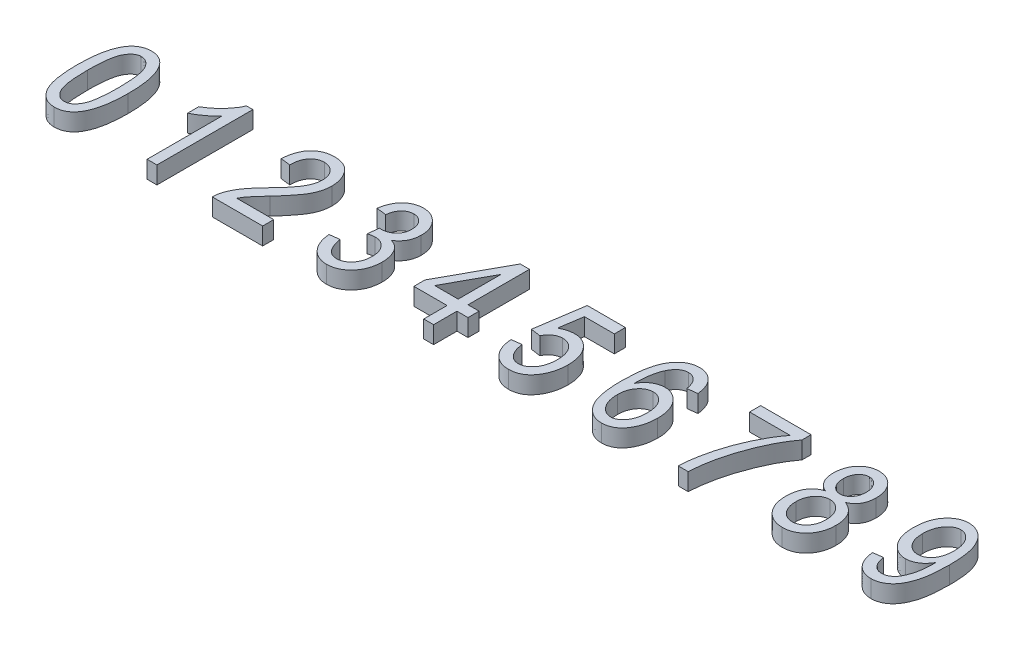
from build123d import *

# Parameters (mm, degrees)
EXTRUDE_1_DEPTH    = 4
EXTRUDE_1_2_DEPTH  = 4
EXTRUDE_1_3_DEPTH  = 4
EXTRUDE_1_4_DEPTH  = 4
EXTRUDE_1_5_DEPTH  = 4
EXTRUDE_1_6_DEPTH  = 4
EXTRUDE_1_7_DEPTH  = 4
EXTRUDE_1_8_DEPTH  = 4
EXTRUDE_1_9_DEPTH  = 4
EXTRUDE_1_10_DEPTH = 4


with BuildPart() as part:
    # 草图1 → 凸台-拉伸1 (new body)
    with BuildSketch(Plane(origin=(0, 0, 0), x_dir=(1, 0, 0), z_dir=(0, 1, 0))):
        with BuildLine():
            add(Edge.make_bspline(
                [(1.133928571, 10.905203683), (1.137529852, 11.35119896), (1.144522674, 12.217214526), (1.216791983, 13.473272052), (1.330782075, 14.646708835), (1.485793215, 15.735951426), (1.695582536, 16.741163355), (1.94263042, 17.663957339), (2.246054489, 18.501398793), (2.587577016, 19.257078625), (2.979224816, 19.926777329), (3.410999943, 20.512796209), (3.895710436, 21.005624194), (4.419990969, 21.415429855), (4.994271432, 21.727630034), (5.610377987, 21.952001951), (6.270588186, 22.087397113), (6.726156325, 22.103427807), (6.958600725, 22.111607143)],
                knots=[0, 0, 0, 0, 1.522295809, 2.955932353, 4.292935845, 5.545987552, 6.709403679, 7.796379217, 8.803980711, 9.746667296, 10.623167879, 11.447716403, 12.224665142, 12.975696349, 13.710987297, 14.4460191, 15.207112772, 16, 16, 16, 16], degree=3))
            add(Edge.make_bspline(
                [(6.958600725, 22.111607143), (7.165745814, 22.104962062), (7.572531355, 22.091912644), (8.166134358, 21.984299805), (8.724456336, 21.801225178), (9.247919006, 21.546805984), (9.734932291, 21.218327908), (10.190287784, 20.821156924), (10.608995529, 20.347285231), (10.851450348, 19.991296179), (10.976074219, 19.808314732)],
                knots=[0, 0, 0, 0, 1.02435884, 2.0116063, 2.972586715, 3.92329494, 4.881606269, 5.870473939, 6.905405214, 8, 8, 8, 8], degree=3))
            add(Edge.make_bspline(
                [(10.976074219, 19.808314732), (11.120329906, 19.561614301), (11.420324827, 19.048574728), (11.778533319, 18.188988192), (12.080470031, 17.228902198), (12.335050794, 16.165261158), (12.516649075, 14.99587192), (12.660372982, 13.725283268), (12.74355333, 12.350301469), (12.752210324, 11.398455669), (12.756696429, 10.905203683)],
                knots=[0, 0, 0, 0, 0.745747152, 1.550859881, 2.42529298, 3.372802996, 4.404287875, 5.514077945, 6.711780846, 8, 8, 8, 8], degree=3))
            add(Edge.make_bspline(
                [(12.756696429, 10.905203683), (12.753138803, 10.462155677), (12.746232095, 9.602030675), (12.673239555, 8.351955016), (12.560768223, 7.184220416), (12.403651674, 6.0983), (12.195807953, 5.095555907), (11.945477506, 4.173012857), (11.651522887, 3.331079351), (11.305272962, 2.575318947), (10.919390548, 1.901712989), (10.48029085, 1.321632525), (10.007261895, 0.819996036), (9.476175946, 0.419066702), (8.905813914, 0.098029702), (8.285555125, -0.12256056), (7.623144178, -0.259853395), (7.165996812, -0.275482839), (6.932024275, -0.283482143)],
                knots=[0, 0, 0, 0, 1.513874866, 2.939007974, 4.277477108, 5.521918538, 6.686610019, 7.774777114, 8.786532326, 9.730252297, 10.61206932, 11.433487149, 12.211385775, 12.960169701, 13.698700869, 14.439280195, 15.201208188, 16, 16, 16, 16], degree=3))
            add(Edge.make_bspline(
                [(6.932024275, -0.283482143), (6.723338871, -0.275649401), (6.313039884, -0.260249351), (5.71102332, -0.143160033), (5.14124749, 0.058723627), (4.600702622, 0.336080314), (4.088670117, 0.690678413), (3.611406087, 1.129987143), (3.157379678, 1.642442393), (2.732051489, 2.237491832), (2.347702748, 2.930431249), (2.022804647, 3.737753777), (1.746001423, 4.655603116), (1.526344673, 5.687684837), (1.341459696, 6.829780524), (1.225266592, 8.087618572), (1.148252418, 9.458771727), (1.1388279, 10.410466121), (1.133928571, 10.905203683)],
                knots=[0, 0, 0, 0, 0.713782411, 1.403376538, 2.088831486, 2.775699897, 3.476400496, 4.213162367, 4.989742879, 5.815463779, 6.710980744, 7.6941898, 8.787315853, 9.987366569, 11.302150399, 12.743876293, 14.307306722, 16, 16, 16, 16], degree=3))
        make_face()
        with BuildLine():
            add(Edge.make_bspline(
                [(3.401785714, 10.9140625), (3.405740161, 10.488808859), (3.413294327, 9.67644818), (3.45480889, 8.510698927), (3.533275445, 7.455693007), (3.642257478, 6.50810622), (3.78042876, 5.671852779), (3.950963924, 4.942328507), (4.154173298, 4.322499768), (4.393249178, 3.803541371), (4.658367759, 3.372739202), (4.941548594, 3.005644831), (5.234348733, 2.687276221), (5.554419105, 2.432964272), (5.88671233, 2.227335152), (6.244068769, 2.093161663), (6.613883115, 1.996316217), (6.869367785, 1.98838346), (6.998465402, 1.984375)],
                knots=[0, 0, 0, 0, 1.930873368, 3.688541263, 5.295281011, 6.732986767, 8.018032389, 9.141589856, 10.131594649, 10.974379403, 11.729767228, 12.422984227, 13.077418253, 13.687793181, 14.274134012, 14.843047171, 15.415386244, 16, 16, 16, 16], degree=3))
            add(Edge.make_bspline(
                [(6.998465402, 1.984375), (7.12015937, 1.988577871), (7.362471427, 1.996946457), (7.715686044, 2.092803168), (8.056201196, 2.233414275), (8.378294063, 2.436914403), (8.681502115, 2.698655197), (8.969934794, 3.016432221), (9.244021563, 3.390594826), (9.506854351, 3.827857087), (9.743390125, 4.349451938), (9.944581903, 4.972226038), (10.113873806, 5.701516287), (10.253908537, 6.53733451), (10.355359306, 7.481174777), (10.436580956, 8.529808855), (10.477017665, 9.686805212), (10.484785748, 10.493245936), (10.488839286, 10.9140625)],
                knots=[0, 0, 0, 0, 0.556098029, 1.107279675, 1.665020537, 2.239289732, 2.843790749, 3.494855459, 4.20099618, 4.965402842, 5.827994078, 6.818278647, 7.958442113, 9.254955883, 10.697998423, 12.305588537, 14.072183745, 16, 16, 16, 16], degree=3))
            add(Edge.make_bspline(
                [(10.488839286, 10.9140625), (10.484803786, 11.339311075), (10.477066782, 12.154612777), (10.436445609, 13.321904263), (10.3565553, 14.379714291), (10.249501411, 15.326124774), (10.108681639, 16.163291329), (9.941524001, 16.892306317), (9.734992017, 17.51088787), (9.499311347, 18.028811135), (9.228796625, 18.455780917), (8.952595629, 18.828447123), (8.649919313, 19.138938816), (8.33177381, 19.397482964), (7.99352568, 19.598949972), (7.633690617, 19.742914474), (7.255066288, 19.829545416), (6.995956106, 19.838995253), (6.865583147, 19.84375)],
                knots=[0, 0, 0, 0, 1.926173374, 3.692928135, 5.28908838, 6.72993665, 8.005261178, 9.132588719, 10.113846285, 10.954579593, 11.702439438, 12.399284011, 13.051919516, 13.660808713, 14.251466784, 14.827675714, 15.41013748, 16, 16, 16, 16], degree=3))
            add(Edge.make_bspline(
                [(6.865583147, 19.84375), (6.743869359, 19.839658157), (6.502952364, 19.831558872), (6.152674508, 19.735298153), (5.816634719, 19.594548839), (5.496901341, 19.390143507), (5.197508892, 19.124714029), (4.906737199, 18.808905181), (4.638661533, 18.431368163), (4.374864924, 17.998108827), (4.142477119, 17.475118933), (3.94097321, 16.853428195), (3.778905963, 16.122829646), (3.635693389, 15.28952644), (3.535539039, 14.346892328), (3.453959667, 13.298334016), (3.41363159, 12.14131465), (3.405847569, 11.334877302), (3.401785714, 10.9140625)],
                knots=[0, 0, 0, 0, 0.557102101, 1.102712893, 1.655222221, 2.224793741, 2.834805151, 3.487045402, 4.190458401, 4.956245252, 5.811421647, 6.809929224, 7.950602775, 9.242777249, 10.688425301, 12.298918027, 14.068702942, 16, 16, 16, 16], degree=3))
        make_face(mode=Mode.SUBTRACT)
    extrude(amount=EXTRUDE_1_DEPTH)


with BuildPart() as body_2:
    # 草图1 → Extrude 1 2 (new body)
    with BuildSketch(Plane(origin=(0, 0, 0), x_dir=(1, 0, 0), z_dir=(0, 1, 0))):
        with BuildLine():
            Line((30.332589286, 0), (28.064732143, 0))
            Line((28.064732143, 0), (28.064732143, 17.292410714))
            add(Edge.make_bspline(
                [(28.064732143, 17.292410714), (27.925454756, 17.132090497), (27.636802515, 16.799827011), (27.135717027, 16.327302036), (26.577312613, 15.840032375), (25.959084786, 15.367208673), (25.329159841, 14.914320071), (24.706991895, 14.515996674), (24.11589952, 14.169425288), (23.719359966, 13.981047717), (23.529017857, 13.890625)],
                knots=[0, 0, 0, 0, 0.892555828, 1.849821039, 2.893015883, 4.008277588, 5.121255548, 6.154629642, 7.114207698, 8, 8, 8, 8], degree=3))
            Line((23.529017857, 13.890625), (23.529017857, 16.441964286))
            add(Edge.make_bspline(
                [(23.529017857, 16.441964286), (23.83491298, 16.626063613), (24.444083923, 16.992685871), (25.297612139, 17.627794014), (26.103929215, 18.313288839), (26.838934536, 19.056352798), (27.497051072, 19.8223405), (28.061927625, 20.586797168), (28.525090621, 21.341600562), (28.752286898, 21.860818224), (28.86202567, 22.111607143)],
                knots=[0, 0, 0, 0, 1.082272232, 2.155277244, 3.222407096, 4.289527553, 5.32168536, 6.282742408, 7.170542132, 8, 8, 8, 8], degree=3))
            Line((28.86202567, 22.111607143), (30.332589286, 22.111607143))
            Line((30.332589286, 22.111607143), (30.332589286, 0))
        make_face()
    extrude(amount=EXTRUDE_1_2_DEPTH)


with BuildPart() as body_3:
    # 草图1 → Extrude 1 3 (new body)
    with BuildSketch(Plane(origin=(0, 0, 0), x_dir=(1, 0, 0), z_dir=(0, 1, 0))):
        with BuildLine():
            Line((54.712053571, 2.551339286), (54.712053571, 0))
            Line((54.712053571, 0), (43.089285714, 0))
            add(Edge.make_bspline(
                [(43.089285714, 0), (43.088747573, 0.132935451), (43.087657288, 0.402264849), (43.123905785, 0.812881285), (43.198381432, 1.233438985), (43.293479235, 1.669548249), (43.428317547, 2.11547331), (43.593384654, 2.573380891), (43.788149325, 3.042130982), (44.016200988, 3.524499695), (44.282690832, 4.025113968), (44.604266837, 4.541879332), (44.97383741, 5.084065389), (45.391891298, 5.648366808), (45.866604654, 6.229431853), (46.383887479, 6.835886378), (46.951122103, 7.466467238), (47.354994361, 7.885557126), (47.562988281, 8.101388114)],
                knots=[0, 0, 0, 0, 0.672188691, 1.361865275, 2.08134618, 2.831455259, 3.618325166, 4.435686407, 5.292818481, 6.184803937, 7.133719261, 8.159707436, 9.261705982, 10.452168352, 11.710682541, 13.056179633, 14.483934645, 16, 16, 16, 16], degree=3))
            add(Edge.make_bspline(
                [(47.562988281, 8.101388114), (47.804700532, 8.351398073), (48.270098671, 8.832772802), (48.925102107, 9.543552089), (49.520238511, 10.204212605), (50.043617445, 10.826701042), (50.504530799, 11.402539282), (50.907615865, 11.930904009), (51.233609209, 12.423786125), (51.58558933, 13.003732731), (51.921152372, 13.694149979), (52.217809111, 14.498940518), (52.40948734, 15.27693348), (52.432851964, 15.789847664), (52.444196429, 16.038888114)],
                knots=[0, 0, 0, 0, 1.312560889, 2.527233899, 3.64818266, 4.668586789, 5.596397896, 6.432357998, 7.175835261, 7.825761013, 8.992224112, 10.065918602, 11.060925749, 12, 12, 12, 12], degree=3))
            add(Edge.make_bspline(
                [(52.444196429, 16.038888114), (52.442614597, 16.176378267), (52.439525115, 16.444910918), (52.387023702, 16.837074135), (52.31214977, 17.210082091), (52.213293991, 17.566630589), (52.073127896, 17.90086324), (51.905185273, 18.215098967), (51.708464326, 18.510760983), (51.483975848, 18.783507376), (51.236416126, 19.029558714), (50.975522917, 19.250604928), (50.694509295, 19.42950948), (50.404924983, 19.585249516), (50.096984366, 19.698120363), (49.777171873, 19.784157133), (49.442528623, 19.832668581), (49.215303524, 19.840019573), (49.099993025, 19.84375)],
                knots=[0, 0, 0, 0, 1.164486654, 2.274364258, 3.346924328, 4.388668322, 5.404300818, 6.412115579, 7.404820287, 8.409522099, 9.400647826, 10.360464378, 11.301161788, 12.219192522, 13.141987859, 14.073903283, 15.022558797, 16, 16, 16, 16], degree=3))
            add(Edge.make_bspline(
                [(49.099993025, 19.84375), (48.975665694, 19.841141763), (48.732973037, 19.836050366), (48.379232658, 19.772778056), (48.040284407, 19.688132211), (47.717848252, 19.556853885), (47.414282657, 19.388694343), (47.125214617, 19.186282336), (46.856302262, 18.945791849), (46.602128572, 18.67232538), (46.379312959, 18.360486939), (46.174735539, 18.023043652), (46.013639439, 17.645701445), (45.876661272, 17.240095662), (45.769385817, 16.801498286), (45.697680736, 16.331563446), (45.645095855, 15.830405725), (45.642142693, 15.485361419), (45.640625, 15.308035714)],
                knots=[0, 0, 0, 0, 0.928788257, 1.813037313, 2.680996359, 3.53827917, 4.408273621, 5.272359245, 6.172129225, 7.102295458, 8.058839945, 9.034325244, 10.048074492, 11.120300332, 12.234644845, 13.420320921, 14.674247329, 16, 16, 16, 16], degree=3))
            Line((45.640625, 15.308035714), (43.372767857, 15.591517857))
            add(Edge.make_bspline(
                [(43.372767857, 15.591517857), (43.396139228, 15.854684649), (43.44148075, 16.365240169), (43.560444291, 17.104348546), (43.725527611, 17.79010871), (43.921491822, 18.429361952), (44.168037381, 19.014174813), (44.443683127, 19.55519021), (44.770389363, 20.040647455), (45.134720718, 20.476548131), (45.533626064, 20.863280911), (45.964857117, 21.197099984), (46.427828295, 21.47850316), (46.91725242, 21.715117857), (47.443246145, 21.891811166), (47.99637313, 22.020051202), (48.581132167, 22.096026734), (48.980176153, 22.10633696), (49.184151786, 22.111607143)],
                knots=[0, 0, 0, 0, 1.296155121, 2.514599762, 3.669097984, 4.755193195, 5.79120272, 6.77953026, 7.729955905, 8.65570694, 9.562583864, 10.450894749, 11.325630111, 12.216772649, 13.112585423, 14.04224033, 14.999270054, 16, 16, 16, 16], degree=3))
            add(Edge.make_bspline(
                [(49.184151786, 22.111607143), (49.404386446, 22.105142393), (49.833219907, 22.092554452), (50.457500354, 22.009609931), (51.039755985, 21.863301393), (51.582587532, 21.659710788), (52.079475738, 21.391689369), (52.538502962, 21.070190347), (52.952008567, 20.685440494), (53.319990817, 20.247649459), (53.645194587, 19.775001467), (53.928956138, 19.280774216), (54.175096496, 18.773156977), (54.367462139, 18.246501373), (54.528107933, 17.707875536), (54.629029131, 17.149114592), (54.700076919, 16.576665628), (54.708038807, 16.189713671), (54.712053571, 15.994594029)],
                knots=[0, 0, 0, 0, 1.141256367, 2.222215694, 3.255808886, 4.246221905, 5.218350639, 6.173592628, 7.142736081, 8.136099926, 9.131465336, 10.11177911, 11.087094076, 12.050634184, 13.014356534, 13.995714735, 14.989343724, 16, 16, 16, 16], degree=3))
            add(Edge.make_bspline(
                [(54.712053571, 15.994594029), (54.708270902, 15.818799772), (54.700754846, 15.46950157), (54.65186227, 14.948328842), (54.565557804, 14.434162879), (54.453495264, 13.922059826), (54.294477751, 13.419948848), (54.114461442, 12.919855211), (53.896115621, 12.427420645), (53.63835295, 11.933032927), (53.336546352, 11.419196882), (52.97488222, 10.876534428), (52.560067648, 10.290539985), (52.075253503, 9.671654686), (51.543931449, 9.002081103), (50.942628569, 8.298690564), (50.283076639, 7.5552804), (49.818403111, 7.050852752), (49.578369141, 6.790283203)],
                knots=[0, 0, 0, 0, 0.78053567, 1.550902233, 2.321464013, 3.094364546, 3.87611052, 4.657966429, 5.453363508, 6.265521698, 7.132350641, 8.097801917, 9.160103787, 10.319208993, 11.587678713, 12.955014444, 14.427067756, 16, 16, 16, 16], degree=3))
            add(Edge.make_bspline(
                [(49.578369141, 6.790283203), (49.42598737, 6.62815642), (49.134773565, 6.318319112), (48.722379926, 5.869980654), (48.352314562, 5.462132734), (48.016520477, 5.100517085), (47.731598557, 4.772972586), (47.484574671, 4.488151746), (47.282737192, 4.242543896), (46.980246169, 3.856432989), (46.598726616, 3.312406226), (46.335143148, 2.799530956), (46.207589286, 2.551339286)],
                knots=[0, 0, 0, 0, 1.227496676, 2.345844757, 3.360613726, 4.265798447, 5.068085109, 5.75545707, 6.345771879, 6.821573405, 8.46188917, 10, 10, 10, 10], degree=3))
            Line((46.207589286, 2.551339286), (54.712053571, 2.551339286))
        make_face()
    extrude(amount=EXTRUDE_1_3_DEPTH)


with BuildPart() as body_4:
    # 草图1 → Extrude 1 4 (new body)
    with BuildSketch(Plane(origin=(0, 0, 0), x_dir=(1, 0, 0), z_dir=(0, 1, 0))):
        with BuildLine():
            Line((64.066964286, 5.953125), (66.334821429, 6.236607143))
            add(Edge.make_bspline(
                [(66.334821429, 6.236607143), (66.36407058, 6.064989661), (66.42106647, 5.730570001), (66.533209116, 5.249325863), (66.655602242, 4.799006435), (66.79745859, 4.38385101), (66.952086142, 3.999804469), (67.123557675, 3.649315572), (67.315269193, 3.332442997), (67.522501789, 3.049003076), (67.74589556, 2.797653575), (67.984434294, 2.580040919), (68.240351997, 2.396320777), (68.511209117, 2.243426439), (68.801291909, 2.130002985), (69.104900744, 2.043438328), (69.426496606, 1.995292497), (69.646392502, 1.98806704), (69.758754185, 1.984375)],
                knots=[0, 0, 0, 0, 1.392235382, 2.712957193, 3.95076201, 5.123471921, 6.220028287, 7.260520794, 8.240826993, 9.178593426, 10.065213643, 10.926376853, 11.755607984, 12.580369742, 13.407158359, 14.241002189, 15.101193065, 16, 16, 16, 16], degree=3))
            add(Edge.make_bspline(
                [(69.758754185, 1.984375), (69.881649092, 1.986713339), (70.123201116, 1.991309384), (70.47717913, 2.059778766), (70.821088311, 2.153254975), (71.148998551, 2.298847697), (71.466683972, 2.477744189), (71.774542447, 2.693579396), (72.060475822, 2.960404227), (72.338920269, 3.253713953), (72.595733262, 3.579332016), (72.817166729, 3.934978565), (73.003657154, 4.315440877), (73.160148336, 4.716168687), (73.27213586, 5.143675666), (73.364387182, 5.589441951), (73.410661978, 6.062890222), (73.418075141, 6.385652688), (73.421875, 6.551095145)],
                knots=[0, 0, 0, 0, 0.904038564, 1.776903143, 2.648138989, 3.525264603, 4.411852617, 5.332561374, 6.2875971, 7.288147468, 8.311042921, 9.337403868, 10.368883854, 11.429611823, 12.501164111, 13.621320171, 14.780729868, 16, 16, 16, 16], degree=3))
            add(Edge.make_bspline(
                [(73.421875, 6.551095145), (73.417858291, 6.706216729), (73.410037885, 7.008233495), (73.36702451, 7.450001205), (73.288213701, 7.868532847), (73.17045868, 8.262685194), (73.031014737, 8.638529635), (72.853025768, 8.988392637), (72.642988117, 9.31427664), (72.405364095, 9.613868683), (72.143014921, 9.88387195), (71.866335489, 10.124197498), (71.570839733, 10.323915608), (71.263973821, 10.492081885), (70.93736938, 10.612961468), (70.600544074, 10.709178459), (70.246198176, 10.762319829), (70.005488125, 10.768944346), (69.882777623, 10.772321429)],
                knots=[0, 0, 0, 0, 1.208507307, 2.352925112, 3.453685551, 4.520081629, 5.553915499, 6.572344605, 7.570902253, 8.569592363, 9.545641393, 10.499968035, 11.418701314, 12.319183888, 13.218416966, 14.125267075, 15.044288268, 16, 16, 16, 16], degree=3))
            add(Edge.make_bspline(
                [(69.882777623, 10.772321429), (69.771815719, 10.768829304), (69.535275464, 10.761385056), (69.162809168, 10.697006563), (68.750605187, 10.606523309), (68.467707105, 10.517733111), (68.319196429, 10.471121652)],
                knots=[0, 0, 0, 0, 0.832645691, 1.774971563, 2.831945141, 4, 4, 4, 4], degree=3))
            Line((68.319196429, 10.471121652), (68.602678571, 13.040178571))
            Line((68.602678571, 13.040178571), (68.943743025, 13.009172712))
            add(Edge.make_bspline(
                [(68.943743025, 13.009172712), (69.07535861, 13.010665374), (69.332185113, 13.013578063), (69.707798772, 13.067403212), (70.066104785, 13.138714172), (70.403478044, 13.246942049), (70.724019459, 13.379983489), (71.022735008, 13.548617553), (71.305074363, 13.745249877), (71.565989089, 13.969889974), (71.800214696, 14.223855081), (72.009449895, 14.496491021), (72.182400643, 14.792058944), (72.326115463, 15.104778555), (72.436311546, 15.439169529), (72.516731576, 15.793475082), (72.559476813, 16.169259401), (72.567376477, 16.4256266), (72.571428571, 16.557128906)],
                knots=[0, 0, 0, 0, 1.104467345, 2.155189185, 3.181695374, 4.170183668, 5.126157628, 6.092295424, 7.04536858, 8.012620263, 8.977961638, 9.942904556, 10.893715412, 11.848320646, 12.828840281, 13.845861792, 14.895045293, 16, 16, 16, 16], degree=3))
            add(Edge.make_bspline(
                [(72.571428571, 16.557128906), (72.561264063, 16.792685052), (72.541729697, 17.245381829), (72.391781098, 17.890154), (72.130488855, 18.46087786), (71.770786927, 18.948833077), (71.337931847, 19.342047279), (70.854381453, 19.63671903), (70.318109283, 19.811312691), (69.944564917, 19.832804544), (69.754324777, 19.84375)],
                knots=[0, 0, 0, 0, 1.168747258, 2.246123166, 3.262822778, 4.26410748, 5.234436762, 6.148309006, 7.056963545, 8, 8, 8, 8], degree=3))
            add(Edge.make_bspline(
                [(69.754324777, 19.84375), (69.556648074, 19.834558894), (69.172098366, 19.816679006), (68.622217171, 19.646112449), (68.116319921, 19.384823993), (67.747541479, 19.070559862), (67.486208578, 18.773018761), (67.301818618, 18.522291812), (67.137972026, 18.243486237), (66.999110884, 17.934112558), (66.865464634, 17.60271146), (66.770948316, 17.237977153), (66.676542143, 16.851025552), (66.638127391, 16.581204594), (66.618303571, 16.441964286)],
                knots=[0, 0, 0, 0, 1.389180941, 2.702438466, 4.019316734, 5.377896697, 6.085434137, 6.807430375, 7.567469407, 8.358691296, 9.195188439, 10.081130764, 11.009773198, 12, 12, 12, 12], degree=3))
            Line((66.618303571, 16.441964286), (64.350446429, 16.725446429))
            add(Edge.make_bspline(
                [(64.350446429, 16.725446429), (64.387581097, 16.941562785), (64.460019745, 17.363141256), (64.611361017, 17.969769445), (64.791477192, 18.536485464), (65.009554686, 19.060168676), (65.257171841, 19.545365372), (65.537327643, 19.990027945), (65.846373061, 20.397075748), (66.195044738, 20.755266076), (66.565624018, 21.074288165), (66.958326126, 21.349801531), (67.366149467, 21.586944958), (67.795815921, 21.777991796), (68.243290997, 21.929483023), (68.710815196, 22.035495427), (69.195986284, 22.098166357), (69.525288243, 22.107084024), (69.692313058, 22.111607143)],
                knots=[0, 0, 0, 0, 1.259750421, 2.457396855, 3.589696629, 4.673763457, 5.713494597, 6.716289503, 7.690389722, 8.644478697, 9.583164327, 10.496506905, 11.397350125, 12.289843847, 13.194037124, 14.107891875, 15.040306322, 16, 16, 16, 16], degree=3))
            add(Edge.make_bspline(
                [(69.692313058, 22.111607143), (69.868302894, 22.106415848), (70.214536049, 22.096202769), (70.723426242, 22.017838678), (71.212839841, 21.89569508), (71.681473898, 21.717617229), (72.125162927, 21.48304569), (72.554835918, 21.207980358), (72.963248077, 20.878419355), (73.343998494, 20.499746992), (73.693493339, 20.085372693), (74.000037692, 19.640150217), (74.263331773, 19.171595912), (74.472405487, 18.672922237), (74.635825349, 18.149163558), (74.755242627, 17.599468102), (74.828366397, 17.022720614), (74.835590704, 16.629696012), (74.839285714, 16.42867606)],
                knots=[0, 0, 0, 0, 0.987546189, 1.94284647, 2.883618689, 3.814886987, 4.749064414, 5.696240478, 6.674807358, 7.688712876, 8.706405422, 9.713376545, 10.718845743, 11.717906576, 12.742863162, 13.794678478, 14.872046121, 16, 16, 16, 16], degree=3))
            add(Edge.make_bspline(
                [(74.839285714, 16.42867606), (74.832462556, 16.185952705), (74.819137027, 15.711917553), (74.690692887, 15.024289592), (74.486852408, 14.379177042), (74.202545234, 13.78087087), (73.84826538, 13.23244492), (73.422731017, 12.747330376), (72.93708344, 12.317328462), (72.567818402, 12.091429338), (72.380964007, 11.977120536)],
                knots=[0, 0, 0, 0, 1.090109576, 2.128968013, 3.132278696, 4.123864162, 5.09769889, 6.057339906, 7.016980922, 8, 8, 8, 8], degree=3))
            add(Edge.make_bspline(
                [(72.380964007, 11.977120536), (72.552601968, 11.924309335), (72.887960762, 11.821122952), (73.350613519, 11.588752422), (73.772473944, 11.318898062), (74.149413914, 10.995219117), (74.484664892, 10.617606013), (74.784022276, 10.183436759), (75.041224561, 9.688561824), (75.273593763, 9.145315527), (75.455694457, 8.554084745), (75.595601084, 7.926690062), (75.674936922, 7.263320644), (75.684725719, 6.809682311), (75.689732143, 6.577671596)],
                knots=[0, 0, 0, 0, 0.945190562, 1.846782401, 2.71900073, 3.580139159, 4.456653473, 5.37426406, 6.352713278, 7.392141409, 8.485180558, 9.608884637, 10.777077804, 12, 12, 12, 12], degree=3))
            add(Edge.make_bspline(
                [(75.689732143, 6.577671596), (75.68538826, 6.330821246), (75.676907655, 5.848892952), (75.588220284, 5.14253238), (75.453997683, 4.470691734), (75.26253142, 3.830969493), (75.015113652, 3.228314915), (74.709569706, 2.659281517), (74.352342809, 2.123810405), (73.941053849, 1.629411742), (73.491333621, 1.186751961), (73.020078323, 0.791176309), (72.523729868, 0.459320075), (72.00651569, 0.18516261), (71.466122491, -0.023020832), (70.905442026, -0.17517067), (70.321230464, -0.265035089), (69.924425461, -0.277277507), (69.723318917, -0.283482143)],
                knots=[0, 0, 0, 0, 1.16797173, 2.280242353, 3.364490462, 4.408173669, 5.436152277, 6.443028727, 7.460738993, 8.478233232, 9.481512989, 10.444418881, 11.386528098, 12.302557467, 13.209825675, 14.12198051, 15.04819242, 16, 16, 16, 16], degree=3))
            add(Edge.make_bspline(
                [(69.723318917, -0.283482143), (69.536985237, -0.278561808), (69.169947734, -0.268869801), (68.631071956, -0.186552927), (68.113992129, -0.054440358), (67.620652911, 0.133983576), (67.145291827, 0.369610546), (66.695276302, 0.663001211), (66.265004785, 1.008607338), (65.860701891, 1.404067311), (65.491248155, 1.846747145), (65.155678452, 2.323997975), (64.860929792, 2.838337999), (64.621004253, 3.394802068), (64.415683439, 3.982259274), (64.251476067, 4.605391819), (64.131055831, 5.265952925), (64.088624918, 5.720885603), (64.066964286, 5.953125)],
                knots=[0, 0, 0, 0, 0.959274814, 1.889566238, 2.800731978, 3.703256649, 4.604498869, 5.528396462, 6.464265966, 7.442996794, 8.436156864, 9.429840861, 10.444772988, 11.483305447, 12.546329121, 13.647537524, 14.799087218, 16, 16, 16, 16], degree=3))
        make_face()
    extrude(amount=EXTRUDE_1_4_DEPTH)


with BuildPart() as body_5:
    # 草图1 → Extrude 1 5 (new body)
    with BuildSketch(Plane(origin=(0, 0, 0), x_dir=(1, 0, 0), z_dir=(0, 1, 0))):
        Polygon((91.848214286, 0), (91.848214286, 5.386160714), (84.194196429, 5.386160714), (84.194196429, 7.9375), (91.976667132, 22.111607143), (94.116071429, 22.111607143), (94.116071429, 7.9375), (96.667410714, 7.9375), (96.667410714, 5.386160714), (94.116071429, 5.386160714), (94.116071429, 0), align=None)
        Polygon((91.848214286, 7.9375), (91.848214286, 17.80179269), (86.431047712, 7.9375), align=None, mode=Mode.SUBTRACT)
    extrude(amount=EXTRUDE_1_5_DEPTH)


with BuildPart() as body_6:
    # 草图1 → Extrude 1 6 (new body)
    with BuildSketch(Plane(origin=(0, 0, 0), x_dir=(1, 0, 0), z_dir=(0, 1, 0))):
        with BuildLine():
            Line((106.022321429, 5.953125), (108.290178571, 6.236607143))
            add(Edge.make_bspline(
                [(108.290178571, 6.236607143), (108.313197272, 6.063508559), (108.358056728, 5.726169439), (108.457957485, 5.240553853), (108.568147226, 4.785523611), (108.715271374, 4.370017852), (108.86452586, 3.980682859), (109.049035744, 3.631850819), (109.246526747, 3.313206313), (109.470937926, 3.035131074), (109.70398502, 2.784923737), (109.952233111, 2.573226566), (110.209183934, 2.392948331), (110.473217609, 2.241338496), (110.74984216, 2.124830666), (111.035930705, 2.045972239), (111.329915182, 1.995202004), (111.529345798, 1.988005447), (111.629952567, 1.984375)],
                knots=[0, 0, 0, 0, 1.411223046, 2.750228965, 4.006672634, 5.191927097, 6.311278306, 7.373684419, 8.377051755, 9.337097037, 10.257438676, 11.13782359, 11.969011532, 12.792190119, 13.594685164, 14.388253401, 15.186922146, 16, 16, 16, 16], degree=3))
            add(Edge.make_bspline(
                [(111.629952567, 1.984375), (111.755767613, 1.988488383), (112.004758271, 1.996628855), (112.370663198, 2.066068328), (112.724700858, 2.175675274), (113.061424825, 2.338953223), (113.387764896, 2.539018727), (113.700600045, 2.785024375), (113.995034307, 3.079687341), (114.278740388, 3.411172314), (114.541243477, 3.780112428), (114.76049944, 4.19186993), (114.951151915, 4.631906604), (115.113200245, 5.103210531), (115.230260408, 5.609771854), (115.312459272, 6.147393434), (115.368169798, 6.716780323), (115.374154836, 7.107585183), (115.377232143, 7.308523996)],
                knots=[0, 0, 0, 0, 0.833557162, 1.649627401, 2.46080936, 3.284070299, 4.12358479, 4.995082037, 5.915776015, 6.88098611, 7.885890802, 8.910954604, 9.967600199, 11.063514457, 12.210406555, 13.409466691, 14.668034258, 16, 16, 16, 16], degree=3))
            add(Edge.make_bspline(
                [(115.377232143, 7.308523996), (115.373721989, 7.496151897), (115.366882898, 7.861721057), (115.316988703, 8.394319451), (115.239946715, 8.895376388), (115.125167888, 9.364183591), (114.972212566, 9.798081548), (114.798260861, 10.204507513), (114.583415276, 10.575704156), (114.334837946, 10.909776778), (114.067371336, 11.212041998), (113.775358732, 11.470846086), (113.470191158, 11.6924797), (113.148750264, 11.879644204), (112.804958739, 12.01287636), (112.44889146, 12.119220768), (112.073146788, 12.174991676), (111.817617838, 12.184759569), (111.687534877, 12.189732143)],
                knots=[0, 0, 0, 0, 1.312040837, 2.556345105, 3.737883698, 4.854849349, 5.925960309, 6.952388988, 7.9424386, 8.917239489, 9.860521384, 10.760061641, 11.639947922, 12.495504232, 13.352616949, 14.212152034, 15.089854369, 16, 16, 16, 16], degree=3))
            add(Edge.make_bspline(
                [(111.687534877, 12.189732143), (111.530456294, 12.182903982), (111.217100465, 12.169282495), (110.754364139, 12.058896304), (110.309932144, 11.874118576), (109.884791261, 11.625986418), (109.489255925, 11.316302733), (109.137543365, 10.942563129), (108.823925716, 10.516588413), (108.658162306, 10.19895853), (108.573660714, 10.037039621)],
                knots=[0, 0, 0, 0, 0.943378558, 1.881944462, 2.841095037, 3.827409543, 4.832274565, 5.849176661, 6.903569879, 8, 8, 8, 8], degree=3))
            Line((108.573660714, 10.037039621), (106.305803571, 10.36038644))
            Line((106.305803571, 10.36038644), (108.006696429, 21.544642857))
            Line((108.006696429, 21.544642857), (116.794642857, 21.544642857))
            Line((116.794642857, 21.544642857), (116.794642857, 18.993303571))
            Line((116.794642857, 18.993303571), (109.906912667, 18.993303571))
            Line((109.906912667, 18.993303571), (109.087472098, 13.602713449))
            add(Edge.make_bspline(
                [(109.087472098, 13.602713449), (109.342951725, 13.733367862), (109.84856663, 13.991943542), (110.653068081, 14.261233083), (111.479845119, 14.427410393), (112.03963527, 14.447495928), (112.32094029, 14.457589286)],
                knots=[0, 0, 0, 0, 1.017619267, 2.013951072, 3.001973272, 4, 4, 4, 4], degree=3))
            add(Edge.make_bspline(
                [(112.32094029, 14.457589286), (112.497013166, 14.451380679), (112.846951918, 14.439041289), (113.361354807, 14.347866936), (113.858831293, 14.20192091), (114.337061942, 13.990185836), (114.796297319, 13.719228307), (115.239973985, 13.391155337), (115.665944434, 13.005362744), (116.0651294, 12.558009022), (116.437204513, 12.065875703), (116.762046831, 11.525537834), (117.037743143, 10.94429508), (117.256509783, 10.319368231), (117.436719098, 9.657061729), (117.558420763, 8.951182099), (117.628391654, 8.204690159), (117.639434631, 7.694033672), (117.645089286, 7.432547433)],
                knots=[0, 0, 0, 0, 0.861018809, 1.711245113, 2.547675859, 3.391805506, 4.262674834, 5.151129072, 6.086914488, 7.068866089, 8.080081396, 9.100796714, 10.1476286, 11.221399762, 12.335728169, 13.501851446, 14.720800604, 16, 16, 16, 16], degree=3))
            add(Edge.make_bspline(
                [(117.645089286, 7.432547433), (117.639697589, 7.172521646), (117.629075068, 6.660228455), (117.553744732, 5.906351544), (117.424450838, 5.181233671), (117.247086005, 4.483862892), (117.022717952, 3.812984094), (116.741638201, 3.171612088), (116.408596719, 2.560391136), (116.030951142, 1.981658802), (115.609953974, 1.45351251), (115.151792887, 0.985588833), (114.652946428, 0.595167288), (114.121571957, 0.271664769), (113.554029541, 0.021826121), (112.951180032, -0.155041787), (112.313092835, -0.264303803), (111.875489635, -0.277000609), (111.652099609, -0.283482143)],
                knots=[0, 0, 0, 0, 1.144340564, 2.254537473, 3.330370625, 4.383172833, 5.418849903, 6.440219285, 7.460844228, 8.47914966, 9.47775429, 10.428908251, 11.354479858, 12.258284926, 13.160219244, 14.07516849, 15.0174017, 16, 16, 16, 16], degree=3))
            add(Edge.make_bspline(
                [(111.652099609, -0.283482143), (111.465820004, -0.278147568), (111.099100394, -0.26764565), (110.560017981, -0.191382088), (110.043195785, -0.062898533), (109.548305735, 0.119446933), (109.077543284, 0.356645866), (108.626414662, 0.641011182), (108.201320703, 0.980697198), (107.797358301, 1.365551677), (107.426175239, 1.797700592), (107.097841753, 2.275707935), (106.808446458, 2.790867753), (106.56454801, 3.347436441), (106.367055954, 3.942902502), (106.207316741, 4.576427115), (106.085896714, 5.249706621), (106.043846272, 5.714966883), (106.022321429, 5.953125)],
                knots=[0, 0, 0, 0, 0.958587677, 1.88712499, 2.795765124, 3.694982091, 4.595578744, 5.504218877, 6.434682167, 7.391400486, 8.372260331, 9.360890354, 10.371359061, 11.409147611, 12.483330096, 13.596558593, 14.769722824, 16, 16, 16, 16], degree=3))
        make_face()
    extrude(amount=EXTRUDE_1_6_DEPTH)


with BuildPart() as body_7:
    # 草图1 → Extrude 1 7 (new body)
    with BuildSketch(Plane(origin=(0, 0, 0), x_dir=(1, 0, 0), z_dir=(0, 1, 0))):
        with BuildLine():
            Line((138.339285714, 16.725446429), (136.071428571, 16.441964286))
            add(Edge.make_bspline(
                [(136.071428571, 16.441964286), (136.019007202, 16.700249575), (135.920845983, 17.183899648), (135.70793543, 17.839092254), (135.470713728, 18.386896412), (135.251340491, 18.677568415), (135.150111607, 18.811697824)],
                knots=[0, 0, 0, 0, 1.230211225, 2.30362229, 3.217213433, 4, 4, 4, 4], degree=3))
            add(Edge.make_bspline(
                [(135.150111607, 18.811697824), (135.076496022, 18.894559618), (134.93335636, 19.0556778), (134.695457636, 19.264384584), (134.450521419, 19.444255711), (134.192938816, 19.592359203), (133.919673419, 19.703089788), (133.635812276, 19.782346223), (133.341730784, 19.83287348), (133.142313309, 19.840102949), (133.04171317, 19.84375)],
                knots=[0, 0, 0, 0, 1.09495211, 2.12904747, 3.12182315, 4.09596367, 5.058329339, 6.028853599, 7.005615717, 8, 8, 8, 8], degree=3))
            add(Edge.make_bspline(
                [(133.04171317, 19.84375), (132.885867072, 19.837967651), (132.57710459, 19.826511653), (132.129025416, 19.703004608), (131.702454647, 19.517552667), (131.303358736, 19.249336695), (130.930976444, 18.907842455), (130.577382921, 18.496291128), (130.255876876, 18.005235611), (130.069237107, 17.644158329), (129.972133092, 17.456298828)],
                knots=[0, 0, 0, 0, 0.906800098, 1.796553483, 2.691003266, 3.610512055, 4.585978966, 5.630213089, 6.767058994, 8, 8, 8, 8], degree=3))
            add(Edge.make_bspline(
                [(129.972133092, 17.456298828), (129.890635205, 17.275981436), (129.721199321, 16.901097642), (129.522510161, 16.290184299), (129.347909427, 15.620616877), (129.216990982, 14.886548988), (129.097964853, 14.095586382), (129.022075289, 13.240689008), (128.972476142, 12.326160552), (128.965711269, 11.695187113), (128.962227958, 11.370291574)],
                knots=[0, 0, 0, 0, 0.763508889, 1.587351645, 2.476402758, 3.433472996, 4.464603951, 5.563935012, 6.745641893, 8, 8, 8, 8], degree=3))
            add(Edge.make_bspline(
                [(128.962227958, 11.370291574), (129.090636676, 11.591372621), (129.340494973, 12.021553178), (129.806088932, 12.585197716), (130.305303309, 13.076416806), (130.859653687, 13.471121097), (131.444805302, 13.78080116), (132.04936118, 14.010296775), (132.673736226, 14.148756635), (133.095664773, 14.165634342), (133.307477679, 14.174107143)],
                knots=[0, 0, 0, 0, 1.127907175, 2.194687167, 3.21896757, 4.214740698, 5.189497801, 6.137088422, 7.064797308, 8, 8, 8, 8], degree=3))
            add(Edge.make_bspline(
                [(133.307477679, 14.174107143), (133.483545387, 14.167982532), (133.830563542, 14.155911317), (134.34264338, 14.064559047), (134.8355991, 13.912643443), (135.314006198, 13.703716381), (135.773109462, 13.428959653), (136.216167826, 13.097039903), (136.637621645, 12.701095012), (137.044850431, 12.258388647), (137.414527252, 11.759703159), (137.738763625, 11.216431804), (138.015440358, 10.63426541), (138.235035517, 10.008049722), (138.413094786, 9.345228898), (138.536694095, 8.639765524), (138.605946326, 7.894606983), (138.617071243, 7.383966753), (138.622767857, 7.122488839)],
                knots=[0, 0, 0, 0, 0.860357646, 1.695709716, 2.533583491, 3.377064945, 4.241047709, 5.143225219, 6.077846286, 7.063889573, 8.080111547, 9.106229702, 10.152257742, 11.225204373, 12.345649275, 13.503769734, 14.721782881, 16, 16, 16, 16], degree=3))
            add(Edge.make_bspline(
                [(138.622767857, 7.122488839), (138.613724774, 6.767643464), (138.596010346, 6.072539542), (138.447539129, 5.054805098), (138.197576255, 4.089380264), (137.914256555, 3.324242489), (137.642099172, 2.750713724), (137.424182159, 2.350257909), (137.194758469, 1.978261119), (136.951850542, 1.634085578), (136.688073099, 1.325758807), (136.417887448, 1.038215078), (136.13045525, 0.781673546), (135.732076634, 0.483929327), (135.208053058, 0.176257079), (134.538638283, -0.087202361), (133.838249197, -0.253732466), (133.358591147, -0.273517488), (133.117013114, -0.283482143)],
                knots=[0, 0, 0, 0, 1.657459496, 3.246784879, 4.79287916, 6.310074839, 7.050696599, 7.757650882, 8.439205885, 9.092012499, 9.723586031, 10.333538589, 10.934530017, 11.52093132, 12.655638276, 13.761218907, 14.872446044, 16, 16, 16, 16], degree=3))
            add(Edge.make_bspline(
                [(133.117013114, -0.283482143), (132.89941204, -0.27587747), (132.471422272, -0.260920182), (131.845159353, -0.140689581), (131.24615184, 0.047456197), (130.681075944, 0.324459942), (130.137571209, 0.665197684), (129.634544404, 1.096371017), (129.156743253, 1.597796392), (128.705914465, 2.174942224), (128.300464275, 2.847565243), (127.946706387, 3.618152306), (127.65115692, 4.492852505), (127.418283776, 5.469580107), (127.227271169, 6.546115366), (127.09298436, 7.723506239), (127.013934714, 9.00388979), (127.004764482, 9.890750596), (127, 10.351527623)],
                knots=[0, 0, 0, 0, 0.760819453, 1.496421576, 2.223429687, 2.951263266, 3.692179274, 4.462099387, 5.262291211, 6.1127328, 7.019077074, 8.003719522, 9.073773746, 10.244022616, 11.513769144, 12.897217303, 14.387919526, 16, 16, 16, 16], degree=3))
            add(Edge.make_bspline(
                [(127, 10.351527623), (127.004193678, 10.862528305), (127.012272148, 11.846891926), (127.098988791, 13.266980399), (127.230200242, 14.5732312), (127.425614598, 15.765138994), (127.668091612, 16.844625153), (127.973196851, 17.809365248), (128.327333106, 18.663577721), (128.748650395, 19.401756053), (129.213135433, 20.038908653), (129.705345956, 20.591620825), (130.226614655, 21.06396084), (130.782590319, 21.449107675), (131.374736052, 21.742882859), (131.994303827, 21.959373742), (132.648392131, 22.084723103), (133.094344628, 22.102553966), (133.320765904, 22.111607143)],
                knots=[0, 0, 0, 0, 1.648816343, 3.176189159, 4.589499976, 5.883521052, 7.071677735, 8.156616623, 9.145117633, 10.049911772, 10.892392766, 11.685345428, 12.434380955, 13.15730553, 13.86047472, 14.561137348, 15.269453316, 16, 16, 16, 16], degree=3))
            add(Edge.make_bspline(
                [(133.320765904, 22.111607143), (133.484803145, 22.106926673), (133.808152597, 22.097700553), (134.283971482, 22.037453752), (134.736927528, 21.924099564), (135.171228441, 21.774004516), (135.582735165, 21.577358564), (135.977774981, 21.343002166), (136.344231111, 21.054837206), (136.695013452, 20.732950932), (137.019568664, 20.369793739), (137.308088125, 19.962868506), (137.563951485, 19.518581315), (137.79290281, 19.037082362), (137.981035905, 18.51420794), (138.134841814, 17.952489936), (138.261268097, 17.353738491), (138.312824256, 16.938546045), (138.339285714, 16.725446429)],
                knots=[0, 0, 0, 0, 0.965625992, 1.903437499, 2.816107718, 3.709373219, 4.603483816, 5.496241877, 6.407089735, 7.341876361, 8.295975248, 9.267838192, 10.27248647, 11.310449055, 12.401896837, 13.538363143, 14.736552469, 16, 16, 16, 16], degree=3))
        make_face()
        with BuildLine():
            add(Edge.make_bspline(
                [(129.267857143, 7.2066476), (129.271095203, 7.014584825), (129.277410055, 6.640024709), (129.331363791, 6.092222823), (129.420423219, 5.574626707), (129.537244385, 5.082624447), (129.698901371, 4.623221541), (129.888076808, 4.187990445), (130.119845104, 3.786210538), (130.380326298, 3.413733969), (130.664860021, 3.08101065), (130.965072972, 2.789771881), (131.272761552, 2.539773146), (131.59697242, 2.339161247), (131.929104565, 2.175638202), (132.277449614, 2.066745832), (132.634352168, 1.996816583), (132.87602332, 1.988534992), (132.997419085, 1.984375)],
                knots=[0, 0, 0, 0, 1.295936842, 2.527331243, 3.710032566, 4.838610101, 5.935196688, 6.992417297, 8.036740745, 9.059547266, 10.056000021, 10.986130286, 11.879343137, 12.725347321, 13.554280309, 14.370418864, 15.181432095, 16, 16, 16, 16], degree=3))
            add(Edge.make_bspline(
                [(132.997419085, 1.984375), (133.105452436, 1.989029587), (133.320332202, 1.998287623), (133.637223854, 2.060548155), (133.942155935, 2.171082426), (134.241388951, 2.316500665), (134.528770669, 2.510507831), (134.810773456, 2.740440213), (135.074404476, 3.020871418), (135.337626304, 3.330872576), (135.573037194, 3.686146112), (135.789644317, 4.069516758), (135.9581949, 4.491783019), (136.10806196, 4.938605693), (136.21453895, 5.421711475), (136.3022259, 5.932593043), (136.342590883, 6.478114136), (136.350721953, 6.850779216), (136.354910714, 7.042759487)],
                knots=[0, 0, 0, 0, 0.772594522, 1.536700729, 2.298102904, 3.086693685, 3.909598938, 4.772126543, 5.683120767, 6.657848237, 7.676972593, 8.726121203, 9.800678132, 10.92259173, 12.09308983, 13.334225679, 14.626713094, 16, 16, 16, 16], degree=3))
            add(Edge.make_bspline(
                [(136.354910714, 7.042759487), (136.350877499, 7.230335913), (136.343053688, 7.594204997), (136.300643311, 8.125922064), (136.220368506, 8.624488607), (136.112773139, 9.092589711), (135.963096322, 9.523355529), (135.79287984, 9.926393082), (135.58295657, 10.295124336), (135.344010491, 10.630687894), (135.085124568, 10.931209263), (134.806479747, 11.191251607), (134.516798434, 11.413187692), (134.209568464, 11.592480663), (133.891589767, 11.737101776), (133.553762207, 11.832084196), (133.205275666, 11.898594058), (132.966732393, 11.903688884), (132.846819196, 11.90625)],
                knots=[0, 0, 0, 0, 1.343777819, 2.606719898, 3.816838752, 4.958326899, 6.041908764, 7.079242616, 8.08798765, 9.073968097, 10.026073332, 10.923948235, 11.799625043, 12.633965371, 13.467232591, 14.293828985, 15.142325764, 16, 16, 16, 16], degree=3))
            add(Edge.make_bspline(
                [(132.846819196, 11.90625), (132.728361503, 11.903794783), (132.494163632, 11.898940674), (132.151728074, 11.831530977), (131.818430651, 11.736511361), (131.499940141, 11.590479461), (131.187970533, 11.414238261), (130.888170827, 11.195301882), (130.607075675, 10.930190168), (130.331653469, 10.636334488), (130.08078755, 10.306388129), (129.86250599, 9.945608281), (129.681243835, 9.55714882), (129.529899249, 9.142270363), (129.40979703, 8.697980758), (129.327496993, 8.224999314), (129.27838033, 7.724450646), (129.271430174, 7.38246185), (129.267857143, 7.2066476)],
                knots=[0, 0, 0, 0, 0.863470541, 1.707132358, 2.539352989, 3.38871181, 4.257816365, 5.15261427, 6.090962397, 7.075009843, 8.09049846, 9.111009759, 10.147788812, 11.215218178, 12.331811356, 13.503305971, 14.716465586, 16, 16, 16, 16], degree=3))
        make_face(mode=Mode.SUBTRACT)
    extrude(amount=EXTRUDE_1_7_DEPTH)


with BuildPart() as body_8:
    # 草图1 → Extrude 1 8 (new body)
    with BuildSketch(Plane(origin=(0, 0, 0), x_dir=(1, 0, 0), z_dir=(0, 1, 0))):
        with BuildLine():
            Line((147.977678571, 18.993303571), (147.977678571, 21.544642857))
            Line((147.977678571, 21.544642857), (159.600446429, 21.544642857))
            Line((159.600446429, 21.544642857), (159.600446429, 19.458391462))
            add(Edge.make_bspline(
                [(159.600446429, 19.458391462), (159.384798646, 19.169677622), (158.945857617, 18.582014032), (158.332010942, 17.641982941), (157.735018637, 16.640834929), (157.154321144, 15.577723645), (156.596740508, 14.449232609), (156.056649692, 13.258901466), (155.539090315, 12.002253109), (155.043746189, 10.695255676), (154.579570771, 9.358470999), (154.168440247, 8.012212296), (153.808424567, 6.669476783), (153.503971933, 5.330325974), (153.24450236, 3.99544986), (153.041730674, 2.662519653), (152.888830069, 1.33122435), (152.827491409, 0.4432307), (152.796875, 0)],
                knots=[0, 0, 0, 0, 0.828235292, 1.685834407, 2.579347319, 3.50739146, 4.469751317, 5.472290501, 6.511687755, 7.593421113, 8.685056077, 9.764080991, 10.828622054, 11.880069368, 12.920502423, 13.954003105, 14.978766756, 16, 16, 16, 16], degree=3))
            Line((152.796875, 0), (150.529017857, 0))
            add(Edge.make_bspline(
                [(150.529017857, 0), (150.53602486, 0.233379048), (150.550319146, 0.709472305), (150.607665542, 1.437355292), (150.679955652, 2.195704774), (150.788288565, 2.981172815), (150.921448826, 3.794942154), (151.083270833, 4.635985002), (151.261803614, 5.508605328), (151.547683428, 6.704409034), (151.950620406, 8.202247102), (152.529684467, 9.965985527), (153.182486706, 11.689409232), (153.925450142, 13.350436201), (154.717718692, 14.932905411), (155.552054792, 16.403866394), (156.404224237, 17.760780902), (157.028645129, 18.589779049), (157.332589286, 18.993303571)],
                knots=[0, 0, 0, 0, 0.54755489, 1.117011975, 1.712111195, 2.334110413, 2.976306168, 3.645990646, 4.342828197, 5.06521062, 6.529487471, 7.979439287, 9.417531512, 10.850025522, 12.245424871, 13.566691952, 14.815558909, 16, 16, 16, 16], degree=3))
            Line((157.332589286, 18.993303571), (147.977678571, 18.993303571))
        make_face()
    extrude(amount=EXTRUDE_1_8_DEPTH)


with BuildPart() as body_9:
    # 草图1 → Extrude 1 9 (new body)
    with BuildSketch(Plane(origin=(0, 0, 0), x_dir=(1, 0, 0), z_dir=(0, 1, 0))):
        with BuildLine():
            add(Edge.make_bspline(
                [(172.459019252, 11.977120536), (172.250355002, 12.081980663), (171.843247475, 12.286564568), (171.300619438, 12.687285083), (170.837916882, 13.152651942), (170.456771115, 13.686017227), (170.161878445, 14.287900923), (169.956849186, 14.956189821), (169.823534032, 15.689588211), (169.81186715, 16.202149454), (169.805803571, 16.468540737)],
                knots=[0, 0, 0, 0, 1.008302473, 1.967215395, 2.901654035, 3.835241807, 4.788827276, 5.786238528, 6.849451133, 8, 8, 8, 8], degree=3))
            add(Edge.make_bspline(
                [(169.805803571, 16.468540737), (169.809864264, 16.672473964), (169.817802315, 17.071133158), (169.885552069, 17.655003742), (169.996824313, 18.208501435), (170.144140242, 18.735694609), (170.347942281, 19.228562633), (170.585576988, 19.698758192), (170.875614117, 20.135820557), (171.201657388, 20.543724293), (171.56350194, 20.90917331), (171.950251725, 21.230406828), (172.360663114, 21.503998988), (172.795615541, 21.724563006), (173.251108803, 21.899158935), (173.728955249, 22.024962904), (174.230226613, 22.094252997), (174.5716489, 22.105772179), (174.744594029, 22.111607143)],
                knots=[0, 0, 0, 0, 1.165528948, 2.278436123, 3.35437051, 4.390847764, 5.401785756, 6.398351761, 7.397951243, 8.394481506, 9.379254266, 10.332413116, 11.264104055, 12.192693114, 13.114390379, 14.047914605, 15.011184464, 16, 16, 16, 16], degree=3))
            add(Edge.make_bspline(
                [(174.744594029, 22.111607143), (174.919083271, 22.106271542), (175.263791001, 22.095730935), (175.768667551, 22.019184404), (176.251163244, 21.894735924), (176.711283102, 21.7217716), (177.148292514, 21.493985122), (177.559378248, 21.213541085), (177.949632593, 20.885631369), (178.313850219, 20.512393499), (178.644429115, 20.098112727), (178.932584155, 19.651765575), (179.184626825, 19.181430645), (179.382755742, 18.676710029), (179.538348895, 18.142943411), (179.647414766, 17.579483296), (179.715628554, 16.988460468), (179.723610751, 16.58537145), (179.727678571, 16.379952567)],
                knots=[0, 0, 0, 0, 0.985268531, 1.946421878, 2.87680472, 3.795226773, 4.71648376, 5.65319809, 6.600248485, 7.590936614, 8.593729089, 9.588305238, 10.588007114, 11.602279753, 12.644649782, 13.724021809, 14.840134863, 16, 16, 16, 16], degree=3))
            add(Edge.make_bspline(
                [(179.727678571, 16.379952567), (179.721205582, 16.123922679), (179.708736841, 15.630739356), (179.580135443, 14.922463355), (179.379933033, 14.273117257), (179.088442578, 13.686362591), (178.715837306, 13.159146845), (178.258249981, 12.696631398), (177.7202751, 12.288495149), (177.311547134, 12.08297163), (177.101039342, 11.977120536)],
                knots=[0, 0, 0, 0, 1.126288406, 2.16953834, 3.158564267, 4.109347243, 5.041996175, 5.989081932, 6.964313779, 8, 8, 8, 8], degree=3))
            add(Edge.make_bspline(
                [(177.101039342, 11.977120536), (177.237884292, 11.921762517), (177.508868098, 11.812141177), (177.89261844, 11.61103153), (178.254645114, 11.390667426), (178.586961178, 11.139798153), (178.899503918, 10.869153206), (179.188166334, 10.572261796), (179.449438759, 10.248205739), (179.683740832, 9.900053054), (179.899973591, 9.53292154), (180.077807747, 9.13755541), (180.235933718, 8.724546636), (180.358038283, 8.288067388), (180.455904926, 7.830947468), (180.525161166, 7.352974623), (180.572314134, 6.853237521), (180.576156963, 6.512821548), (180.578125, 6.338483538)],
                knots=[0, 0, 0, 0, 0.998518868, 1.977292132, 2.928488769, 3.863806314, 4.791620617, 5.724425947, 6.662355446, 7.604692757, 8.562792825, 9.541974082, 10.534927333, 11.553397264, 12.605860047, 13.696849039, 14.820482036, 16, 16, 16, 16], degree=3))
            add(Edge.make_bspline(
                [(180.578125, 6.338483538), (180.5726484, 6.100614252), (180.561905149, 5.633994506), (180.488635471, 4.949992361), (180.35277129, 4.300503731), (180.174057088, 3.682225873), (179.936976379, 3.100335665), (179.65317761, 2.54912691), (179.310144614, 2.036037867), (178.921325668, 1.55870402), (178.496288522, 1.127565015), (178.039667056, 0.751825608), (177.560058997, 0.430702429), (177.053050871, 0.166076493), (176.517299678, -0.030690723), (175.960701254, -0.180799385), (175.377522445, -0.263665555), (174.98106822, -0.276814442), (174.780029297, -0.283482143)],
                knots=[0, 0, 0, 0, 1.159749967, 2.275040396, 3.347967098, 4.391166783, 5.408413163, 6.406504519, 7.408740576, 8.411571025, 9.404143995, 10.355316395, 11.289670068, 12.213679047, 13.136228826, 14.066859406, 15.019719104, 16, 16, 16, 16], degree=3))
            add(Edge.make_bspline(
                [(174.780029297, -0.283482143), (174.576029433, -0.276888397), (174.175141351, -0.26393077), (173.586192968, -0.180618372), (173.026188083, -0.031699529), (172.488486636, 0.16737297), (171.978436151, 0.429106596), (171.498076257, 0.753464895), (171.037171483, 1.125805905), (170.612904232, 1.559295248), (170.220905856, 2.034958893), (169.886660268, 2.556553208), (169.59390794, 3.108755004), (169.360558354, 3.700516761), (169.178143772, 4.32780987), (169.052100639, 4.99237312), (168.969638439, 5.691196845), (168.960176803, 6.169924502), (168.955357143, 6.413783482)],
                knots=[0, 0, 0, 0, 0.984972937, 1.935608695, 2.864070717, 3.777636659, 4.698984135, 5.624239024, 6.571662262, 7.554569506, 8.54763434, 9.542156389, 10.540146702, 11.560717074, 12.60743999, 13.689489912, 14.823049757, 16, 16, 16, 16], degree=3))
            add(Edge.make_bspline(
                [(168.955357143, 6.413783482), (168.957499057, 6.592527824), (168.961701358, 6.943213095), (169.00679716, 7.458174581), (169.081965083, 7.949157471), (169.183436026, 8.415378789), (169.311442065, 8.857289069), (169.471238917, 9.275192804), (169.661426782, 9.669077834), (169.880118371, 10.038871675), (170.122046276, 10.383344766), (170.388466742, 10.699501019), (170.678667184, 10.984473941), (170.989993543, 11.241994634), (171.322940275, 11.475129772), (171.682064157, 11.67216734), (172.061237708, 11.843094776), (172.325299794, 11.932066027), (172.459019252, 11.977120536)],
                knots=[0, 0, 0, 0, 1.21084686, 2.375606163, 3.49898943, 4.574306622, 5.606312177, 6.613285576, 7.602106595, 8.566331322, 9.521116698, 10.451051306, 11.363604456, 12.273026677, 13.186018397, 14.112988761, 15.044428814, 16, 16, 16, 16], degree=3))
        make_face()
        with BuildLine():
            add(Edge.make_bspline(
                [(172.073660714, 16.530552455), (172.082176367, 16.277343923), (172.098470422, 15.792848598), (172.244706456, 15.104009718), (172.493779887, 14.497205866), (172.834719988, 13.978184233), (173.251811136, 13.566272859), (173.717006948, 13.25701265), (174.235093125, 13.071116427), (174.596967397, 13.05057161), (174.780029297, 13.040178571)],
                knots=[0, 0, 0, 0, 1.231806288, 2.356967922, 3.407623546, 4.408504678, 5.359070988, 6.242373184, 7.110866593, 8, 8, 8, 8], degree=3))
            add(Edge.make_bspline(
                [(174.780029297, 13.040178571), (174.960308682, 13.050343489), (175.31676728, 13.070442139), (175.823733382, 13.259774144), (176.288055041, 13.55586674), (176.695684369, 13.965562705), (177.03683223, 14.466460276), (177.286802985, 15.046074768), (177.434537336, 15.694944266), (177.45118297, 16.148831551), (177.459821429, 16.384381975)],
                knots=[0, 0, 0, 0, 0.904069307, 1.787576968, 2.686104763, 3.657927982, 4.673759711, 5.718490521, 6.815982417, 8, 8, 8, 8], degree=3))
            add(Edge.make_bspline(
                [(177.459821429, 16.384381975), (177.451518815, 16.62735631), (177.435496425, 17.096248403), (177.283315733, 17.764151301), (177.028219146, 18.363217333), (176.673059624, 18.876751306), (176.259255855, 19.303699451), (175.793038859, 19.613939006), (175.286374737, 19.808884068), (174.932319271, 19.832047826), (174.753452846, 19.84375)],
                knots=[0, 0, 0, 0, 1.195037322, 2.306184118, 3.351541185, 4.382027117, 5.363972266, 6.261309376, 7.121625266, 8, 8, 8, 8], degree=3))
            add(Edge.make_bspline(
                [(174.753452846, 19.84375), (174.574701562, 19.833476448), (174.221219458, 19.813160416), (173.71493274, 19.624298143), (173.253485444, 19.316965704), (172.845297078, 18.901530403), (172.496640018, 18.40439165), (172.255304055, 17.829949103), (172.097041267, 17.200481562), (172.081631887, 16.758952561), (172.073660714, 16.530552455)],
                knots=[0, 0, 0, 0, 0.904281018, 1.788222997, 2.702503877, 3.698439792, 4.727116192, 5.763971808, 6.843317031, 8, 8, 8, 8], degree=3))
        make_face(mode=Mode.SUBTRACT)
        with BuildLine():
            add(Edge.make_bspline(
                [(171.223214286, 6.422642299), (171.226769361, 6.26009602), (171.233734235, 5.941645862), (171.28364809, 5.476877521), (171.360700604, 5.035981459), (171.478193879, 4.621800279), (171.623181096, 4.229166913), (171.805106378, 3.861446026), (172.02004424, 3.51833996), (172.260172302, 3.199491418), (172.53150305, 2.920181827), (172.811295229, 2.667430082), (173.106166093, 2.455088719), (173.417516908, 2.283788906), (173.740615484, 2.152132199), (174.075361167, 2.052561838), (174.423558364, 1.993340262), (174.660209456, 1.987388475), (174.780029297, 1.984375)],
                knots=[0, 0, 0, 0, 1.229957658, 2.409653497, 3.534020377, 4.613053928, 5.663236106, 6.697665706, 7.711552779, 8.723960985, 9.711901018, 10.6537745, 11.574735704, 12.45493582, 13.336836533, 14.210201145, 15.093799183, 16, 16, 16, 16], degree=3))
            add(Edge.make_bspline(
                [(174.780029297, 1.984375), (174.901375658, 1.987155165), (175.139602239, 1.992613172), (175.489622065, 2.054562547), (175.82585705, 2.145419367), (176.147747299, 2.276151478), (176.456315669, 2.440614675), (176.748505422, 2.645204803), (177.025515277, 2.889093958), (177.289878586, 3.163655583), (177.525770575, 3.475351166), (177.743797192, 3.805548763), (177.911899099, 4.169677732), (178.063076086, 4.550815432), (178.169160319, 4.962188338), (178.257900681, 5.39607697), (178.297600886, 5.857910788), (178.305985414, 6.173079831), (178.310267857, 6.334054129)],
                knots=[0, 0, 0, 0, 0.929108295, 1.824020855, 2.716353585, 3.594799272, 4.480866403, 5.391315445, 6.321801218, 7.306391719, 8.306918377, 9.31465165, 10.332061206, 11.374528197, 12.453461109, 13.583192095, 14.765602254, 16, 16, 16, 16], degree=3))
            add(Edge.make_bspline(
                [(178.310267857, 6.334054129), (178.306564144, 6.496572528), (178.299308069, 6.814968063), (178.251449468, 7.280397292), (178.166919081, 7.72016825), (178.05128536, 8.134988541), (177.905610515, 8.527435158), (177.724213142, 8.896238675), (177.506108378, 9.238436607), (177.256750462, 9.551712505), (176.99030835, 9.838052374), (176.705934926, 10.088320542), (176.406388306, 10.297375577), (176.096075007, 10.47283929), (175.770608334, 10.604334629), (175.434633682, 10.704791892), (175.083288546, 10.763244288), (174.843729622, 10.769270506), (174.722446987, 10.772321429)],
                knots=[0, 0, 0, 0, 1.22586307, 2.401631645, 3.524301147, 4.599742544, 5.646428614, 6.677414549, 7.693861764, 8.700930997, 9.693673486, 10.640764112, 11.552218418, 12.444626848, 13.323591672, 14.194048812, 15.08569251, 16, 16, 16, 16], degree=3))
            add(Edge.make_bspline(
                [(174.722446987, 10.772321429), (174.602654387, 10.769233939), (174.366057097, 10.763135968), (174.018868337, 10.705219696), (173.688720182, 10.602902155), (173.366095152, 10.47961273), (173.064684476, 10.299689684), (172.769876405, 10.094375863), (172.496105605, 9.841919761), (172.235025772, 9.560398974), (171.997672307, 9.247422837), (171.787756631, 8.910407141), (171.614951259, 8.548604972), (171.474322974, 8.1652774), (171.356973879, 7.762078996), (171.278053869, 7.334791778), (171.23522694, 6.885658722), (171.227276996, 6.579235629), (171.223214286, 6.422642299)],
                knots=[0, 0, 0, 0, 0.923472587, 1.823911596, 2.703001348, 3.586871794, 4.479500873, 5.402130619, 6.35347509, 7.344669241, 8.360414412, 9.377945173, 10.401637647, 11.446516964, 12.524200813, 13.636404357, 14.792116778, 16, 16, 16, 16], degree=3))
        make_face(mode=Mode.SUBTRACT)
    extrude(amount=EXTRUDE_1_9_DEPTH)


with BuildPart() as body_10:
    # 草图1 → Extrude 1 10 (new body)
    with BuildSketch(Plane(origin=(0, 0, 0), x_dir=(1, 0, 0), z_dir=(0, 1, 0))):
        with BuildLine():
            Line((190.216517857, 5.102678571), (192.484375, 5.386160714))
            add(Edge.make_bspline(
                [(192.484375, 5.386160714), (192.529727182, 5.118977348), (192.615520502, 4.61354305), (192.833822193, 3.917253655), (193.104927552, 3.322119515), (193.443859236, 2.832025282), (193.849449554, 2.449719548), (194.318449941, 2.176526808), (194.849291499, 2.012013665), (195.223512462, 1.993783414), (195.416643415, 1.984375)],
                knots=[0, 0, 0, 0, 1.309725382, 2.477624782, 3.519252249, 4.462492528, 5.34180128, 6.193195808, 7.067530017, 8, 8, 8, 8], degree=3))
            add(Edge.make_bspline(
                [(195.416643415, 1.984375), (195.594773955, 1.993821524), (195.947935154, 2.012550182), (196.462014227, 2.161178946), (196.946721442, 2.4023315), (197.329106765, 2.672399169), (197.611450356, 2.947991467), (197.827812951, 3.186196827), (198.025084481, 3.470699863), (198.219467463, 3.786111273), (198.400602832, 4.141641286), (198.578866254, 4.528834348), (198.73944167, 4.957076818), (198.958234129, 5.579823623), (199.184056619, 6.425811406), (199.370598821, 7.511017786), (199.487493572, 8.674665188), (199.501959511, 9.477169708), (199.509416853, 9.890869141)],
                knots=[0, 0, 0, 0, 0.871681479, 1.728193698, 2.598433288, 3.51585727, 4.0070026, 4.529633168, 5.089671721, 5.700050678, 6.343889226, 7.043128753, 7.787355008, 8.583454758, 10.276770505, 12.068987891, 13.973522342, 16, 16, 16, 16], degree=3))
            Line((199.509416853, 9.890869141), (199.509416853, 10.426827567))
            add(Edge.make_bspline(
                [(199.509416853, 10.426827567), (199.390743917, 10.220999888), (199.15651081, 9.814743343), (198.71549599, 9.272698623), (198.220968181, 8.794359825), (197.675133304, 8.387855379), (197.093289786, 8.068332815), (196.501729343, 7.827431548), (195.89877699, 7.684630671), (195.49413327, 7.664194905), (195.292619978, 7.654017857)],
                knots=[0, 0, 0, 0, 1.076943371, 2.125638765, 3.158845653, 4.193572763, 5.204435146, 6.163898621, 7.085618246, 8, 8, 8, 8], degree=3))
            add(Edge.make_bspline(
                [(195.292619978, 7.654017857), (195.113569689, 7.660091088), (194.759170029, 7.672112019), (194.237828532, 7.764705581), (193.731581245, 7.908377999), (193.249914818, 8.125561049), (192.782975289, 8.392299622), (192.339963333, 8.724048304), (191.912111795, 9.11187186), (191.508531542, 9.556628606), (191.134314175, 10.051814092), (190.81212127, 10.597715876), (190.54039242, 11.187341458), (190.320691153, 11.820119264), (190.141636242, 12.494610958), (190.019340111, 13.2150741), (189.949682937, 13.979304946), (189.938681482, 14.503215103), (189.933035714, 14.772077288)],
                knots=[0, 0, 0, 0, 0.86465958, 1.711446896, 2.551263658, 3.400931007, 4.257488752, 5.144979063, 6.069240711, 7.043889745, 8.042652401, 9.063041585, 10.100422143, 11.174417838, 12.295707709, 13.468554313, 14.700903177, 16, 16, 16, 16], degree=3))
            add(Edge.make_bspline(
                [(189.933035714, 14.772077288), (189.938163792, 15.048374938), (189.948192829, 15.588733332), (190.025481454, 16.375833436), (190.143764681, 17.119662458), (190.331258497, 17.813510535), (190.551528532, 18.467454568), (190.834253197, 19.072650505), (191.161539502, 19.635824729), (191.54287036, 20.146236445), (191.95665787, 20.606158611), (192.39826667, 21.006986645), (192.857969204, 21.352579328), (193.346708166, 21.6271556), (193.852657391, 21.849290083), (194.384139011, 21.996088263), (194.934573045, 22.095228893), (195.309886792, 22.106084891), (195.500802176, 22.111607143)],
                knots=[0, 0, 0, 0, 1.28857615, 2.520082744, 3.686305779, 4.797202427, 5.868826455, 6.901108228, 7.907493629, 8.90202596, 9.867517396, 10.788992686, 11.680218227, 12.543873392, 13.398473814, 14.25085117, 15.110239307, 16, 16, 16, 16], degree=3))
            add(Edge.make_bspline(
                [(195.500802176, 22.111607143), (195.636826384, 22.108299671), (195.908432965, 22.101695471), (196.311086603, 22.045360635), (196.707242016, 21.962704373), (197.096321521, 21.842363554), (197.47565781, 21.681466414), (197.849241369, 21.488993555), (198.219724565, 21.268980141), (198.575546969, 21.006060318), (198.923097872, 20.714466097), (199.250235276, 20.386562786), (199.555573452, 20.024785494), (199.847052146, 19.636322463), (200.104384152, 19.205888665), (200.356091125, 18.750823635), (200.57952522, 18.258177566), (200.785915192, 17.731091791), (200.968866546, 17.157398171), (201.127577992, 16.528864924), (201.257624625, 15.840601675), (201.369699673, 15.094687633), (201.450417975, 14.288884954), (201.513622843, 13.423441827), (201.547357676, 12.498581646), (201.552932815, 11.861979569), (201.555803571, 11.534179688)],
                knots=[0, 0, 0, 0, 0.71982096, 1.437303798, 2.148671553, 2.860726122, 3.5894893, 4.327127712, 5.084546776, 5.867862187, 6.666549548, 7.484587174, 8.316328227, 9.17150421, 10.052303838, 10.968733071, 11.923593905, 12.913579202, 13.964198915, 15.109293659, 16.343376022, 17.671051532, 19.10143247, 20.629623286, 22.264521701, 24, 24, 24, 24], degree=3))
            add(Edge.make_bspline(
                [(201.555803571, 11.534179688), (201.553388688, 11.167979978), (201.548703457, 10.457498356), (201.508697126, 9.422012649), (201.44177951, 8.45026698), (201.356699937, 7.539548546), (201.237741575, 6.694174905), (201.089704932, 5.911607588), (200.927045853, 5.18938623), (200.725063396, 4.529496821), (200.499754574, 3.924436284), (200.268773608, 3.359636773), (200.0107149, 2.838900825), (199.731878679, 2.36229817), (199.439324068, 1.923250517), (199.125332871, 1.52894706), (198.791331235, 1.176804754), (198.441139377, 0.86602565), (198.075577119, 0.595001061), (197.70036782, 0.358703706), (197.311236834, 0.165317342), (196.916941107, -0.00337174), (196.50572943, -0.12431667), (196.086198072, -0.219922668), (195.654247203, -0.273069594), (195.363622623, -0.27999556), (195.217320033, -0.283482143)],
                knots=[0, 0, 0, 0, 1.764807986, 3.42398863, 4.99306403, 6.458696006, 7.831295522, 9.105472131, 10.296422921, 11.39714146, 12.428197542, 13.407419317, 14.336630445, 15.226313195, 16.067043525, 16.877164758, 17.652279824, 18.403342349, 19.130566392, 19.843339087, 20.537068434, 21.222906937, 21.90719335, 22.599498013, 23.294976811, 24, 24, 24, 24], degree=3))
            add(Edge.make_bspline(
                [(195.217320033, -0.283482143), (195.051690187, -0.27955246), (194.726436381, -0.271835589), (194.249480492, -0.201280574), (193.792817154, -0.09858393), (193.358243316, 0.054879755), (192.944188188, 0.250823327), (192.550435428, 0.489360209), (192.179189918, 0.772836152), (191.828436336, 1.095576186), (191.506768744, 1.462601034), (191.216462281, 1.868563541), (190.963349904, 2.314145781), (190.748024592, 2.799095062), (190.561668406, 3.320245125), (190.405172236, 3.878978349), (190.292451291, 4.478235347), (190.242231597, 4.89122006), (190.216517857, 5.102678571)],
                knots=[0, 0, 0, 0, 0.974221956, 1.913117753, 2.832138983, 3.725325793, 4.619357623, 5.523969086, 6.429456606, 7.364160882, 8.324683532, 9.296460859, 10.296689072, 11.335178463, 12.415402788, 13.551768977, 14.746444432, 16, 16, 16, 16], degree=3))
        make_face()
        with BuildLine():
            add(Edge.make_bspline(
                [(199.287946429, 14.829659598), (199.284370549, 15.018758716), (199.277374254, 15.388735763), (199.228072532, 15.927270209), (199.149998642, 16.437055966), (199.034838644, 16.913764714), (198.889767686, 17.36103171), (198.706817444, 17.774003498), (198.494277849, 18.157269724), (198.250668971, 18.506171366), (197.987106123, 18.817941392), (197.710988099, 19.09235456), (197.42258249, 19.3211637), (197.129044403, 19.516963106), (196.821571066, 19.663728384), (196.502601608, 19.766192102), (196.17511897, 19.829923013), (195.95287877, 19.839143991), (195.841866629, 19.84375)],
                knots=[0, 0, 0, 0, 1.345999961, 2.633481834, 3.846522151, 5.014086171, 6.12088659, 7.189137531, 8.224301127, 9.236041944, 10.213065705, 11.127237019, 12.002136993, 12.83006775, 13.63396595, 14.418389675, 15.209963153, 16, 16, 16, 16], degree=3))
            add(Edge.make_bspline(
                [(195.841866629, 19.84375), (195.724908059, 19.839533405), (195.492040904, 19.83113807), (195.149412199, 19.762274642), (194.815390628, 19.650299936), (194.494348687, 19.489001252), (194.178918935, 19.288139877), (193.880108625, 19.036755294), (193.584197166, 18.747269181), (193.304910165, 18.41285164), (193.044400414, 18.044055261), (192.815696309, 17.641296363), (192.626741958, 17.207019316), (192.473301353, 16.743802904), (192.345125778, 16.253482754), (192.266686065, 15.730767681), (192.209830797, 15.179351605), (192.203922109, 14.801767864), (192.200892857, 14.608189174)],
                knots=[0, 0, 0, 0, 0.795597862, 1.584053309, 2.369106213, 3.187177883, 4.023566861, 4.908945974, 5.83998388, 6.838605549, 7.870313796, 8.9100199, 9.985637853, 11.088521482, 12.229358934, 13.430623134, 14.682738284, 16, 16, 16, 16], degree=3))
            add(Edge.make_bspline(
                [(192.200892857, 14.608189174), (192.204598416, 14.433870905), (192.211836011, 14.093397368), (192.259256434, 13.596969685), (192.345129701, 13.128052909), (192.458423995, 12.68610635), (192.604693139, 12.270163979), (192.786726553, 11.882466465), (193.005226945, 11.523036062), (193.251247476, 11.191930344), (193.522684393, 10.896886765), (193.80393754, 10.631347814), (194.10725443, 10.415323704), (194.42053215, 10.236393699), (194.744011172, 10.090853151), (195.084893592, 9.996673792), (195.436119876, 9.929166732), (195.67616823, 9.924324139), (195.797572545, 9.921875)],
                knots=[0, 0, 0, 0, 1.270391188, 2.481292313, 3.629423926, 4.741182195, 5.802977916, 6.837826839, 7.856438293, 8.863562247, 9.838501743, 10.775102984, 11.676942478, 12.544429056, 13.402050266, 14.253371081, 15.116643449, 16, 16, 16, 16], degree=3))
            add(Edge.make_bspline(
                [(195.797572545, 9.921875), (195.917325813, 9.926910728), (196.153765612, 9.936853226), (196.501791691, 9.992319315), (196.832462701, 10.099590761), (197.153981908, 10.233275364), (197.456705389, 10.419360101), (197.744450878, 10.642385669), (198.022819387, 10.901195815), (198.280894754, 11.202184138), (198.522932954, 11.536731082), (198.723373216, 11.913391709), (198.903402093, 12.315828249), (199.043839732, 12.754527768), (199.15396567, 13.225598991), (199.233816037, 13.730311663), (199.276065573, 14.269357876), (199.283906325, 14.639128102), (199.287946429, 14.829659598)],
                knots=[0, 0, 0, 0, 0.854962158, 1.688029758, 2.504410095, 3.330252108, 4.166776435, 5.030713634, 5.925137581, 6.873583428, 7.855774289, 8.86472059, 9.911937097, 10.998017063, 12.145369077, 13.361241875, 14.64032716, 16, 16, 16, 16], degree=3))
        make_face(mode=Mode.SUBTRACT)
    extrude(amount=EXTRUDE_1_10_DEPTH)


solid = Compound([part.part, body_2.part, body_3.part, body_4.part, body_5.part, body_6.part, body_7.part, body_8.part, body_9.part, body_10.part])
